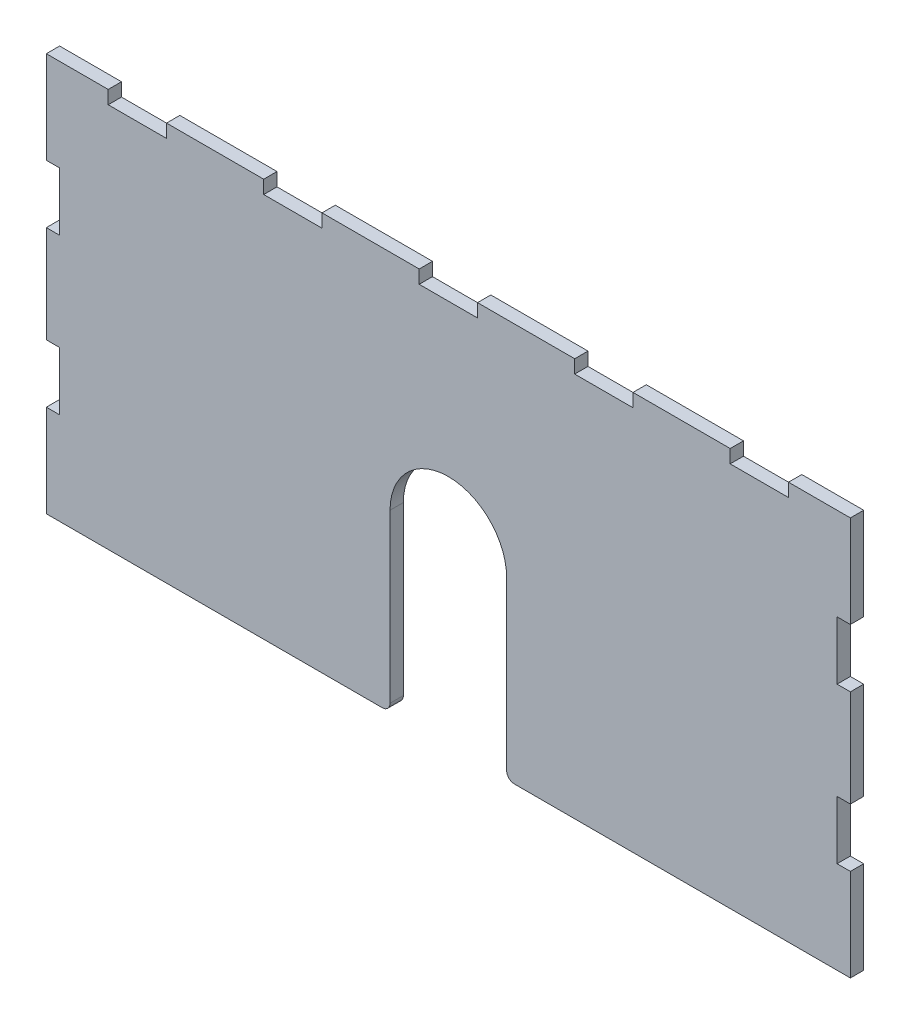
from build123d import *

# Parameters (mm, degrees)
SKETCH1_W           = 262.6868
SKETCH1_H           = 130.175
BOSS_EXTRUDE1_DEPTH = 4.3434
SKETCH2_W           = 19.05
SKETCH2_H           = 8.6868
CUT_EXTRUDE1_DEPTH  = 147.650388692
CUT_EXTRUDE2_DEPTH  = 147.650388692
SKETCH3_W           = 8.6868
SKETCH3_H           = 19.05
CUT_EXTRUDE3_DEPTH  = 147.650388692
FILLET1_R           = 2.54


with BuildPart() as part:
    # Sketch1 → Boss-Extrude1 (new body)
    with BuildSketch(Plane.XY):
        Rectangle(SKETCH1_W, SKETCH1_H)
    extrude(amount=BOSS_EXTRUDE1_DEPTH)

    # Sketch2 → Cut-Extrude1 (cut, through all)
    with BuildSketch(Plane.XY.offset(4.3434)):
        with Locations((-50.8, 65.0875)):
            Rectangle(SKETCH2_W, SKETCH2_H)
        with Locations((0, 65.0875)):
            Rectangle(SKETCH2_W, SKETCH2_H)
        with Locations((50.8, 65.0875)):
            Rectangle(SKETCH2_W, SKETCH2_H)
        with Locations((101.6, 65.0875)):
            Rectangle(SKETCH2_W, SKETCH2_H)
        with Locations((-101.6, 65.0875)):
            Rectangle(SKETCH2_W, SKETCH2_H)
    extrude(amount=-CUT_EXTRUDE1_DEPTH, mode=Mode.SUBTRACT)

    # Sketch4 → Cut-Extrude2 (cut, through all)
    with BuildSketch(Plane.XY.offset(4.3434)):
        with BuildLine():
            Line((-19.05, -65.0875), (-19.05, -7.9375))
            ThreePointArc((-19.05, -7.9375), (0, 11.1125), (19.05, -7.9375))
            Line((19.05, -7.9375), (19.05, -65.0875))
            ThreePointArc((19.05, -65.0875), (0, -84.1375), (-19.05, -65.0875))
        make_face()
    extrude(amount=-CUT_EXTRUDE2_DEPTH, mode=Mode.SUBTRACT)

    # Sketch3 → Cut-Extrude3 (cut, through all)
    with BuildSketch(Plane.XY.offset(4.3434)):
        with Locations((-131.3434, -25.4)):
            Rectangle(SKETCH3_W, SKETCH3_H)
        with Locations((-131.3434, 25.4)):
            Rectangle(SKETCH3_W, SKETCH3_H)
    cut_extrude3 = extrude(amount=-CUT_EXTRUDE3_DEPTH, mode=Mode.SUBTRACT)

    # Mirror1: Cut-Extrude3 across plane
    add(cut_extrude3.mirror(Plane(origin=(0, 0, 0), x_dir=(0, 0, 1), z_dir=(1, 0, 0))), mode=Mode.SUBTRACT)

    # Fillet1
    fillet1_edges = [part.edges().sort_by_distance(p)[0] for p in [
        (19.05, -65.0875, 2.1717),
        (-19.05, -65.0875, 2.1717),
    ]]
    fillet(fillet1_edges, radius=FILLET1_R)


solid = part.part
